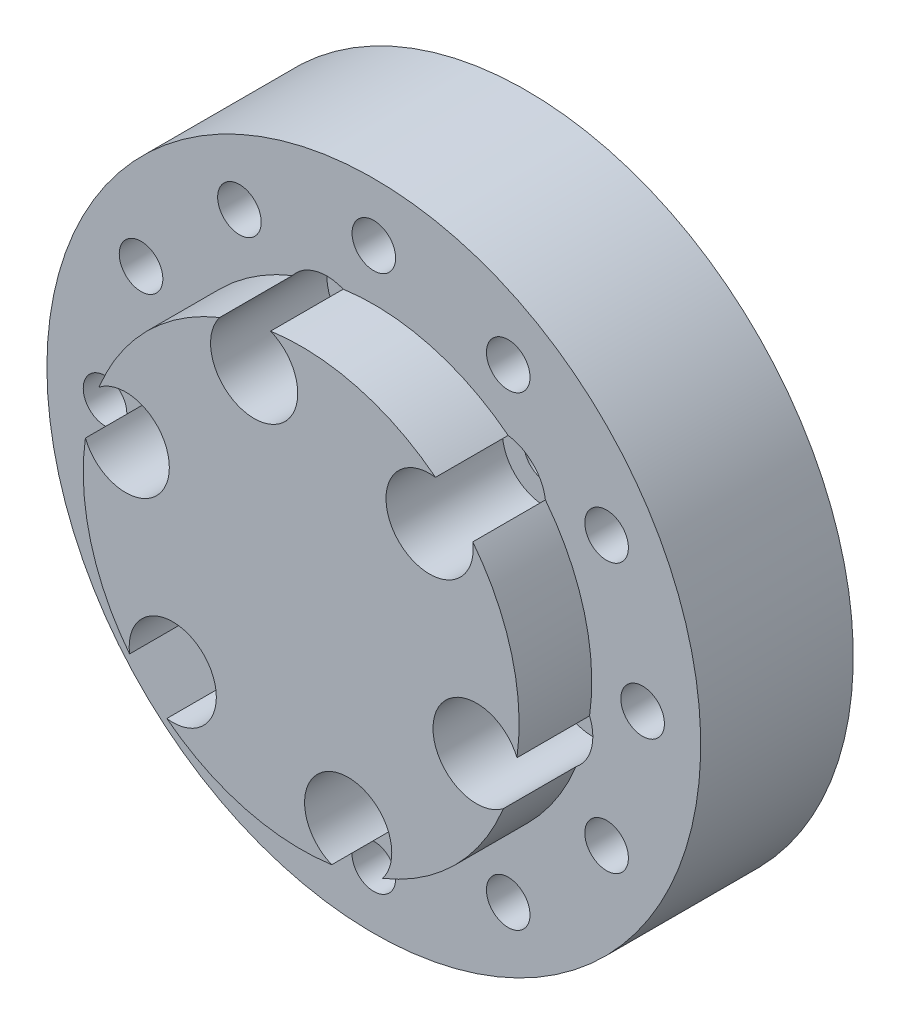
from build123d import *

# Parameters (mm, degrees)
SKETCH_1_R               = 22.5
EXTRUDE_1_DEPTH          = 10.5
SKETCH_2_R               = 15
EXTRUDE_2_DEPTH          = 5
SKETCH_3_R               = 1.5
CUT_EXTRUDE_1_DEPTH      = 5
SKETCH_5_R               = 1.5
CUT_EXTRUDE_2_DEPTH      = 34.507461856
CUT_EXTRUDE_6_DEPTH      = 3
PATTERN_CIRCULAR_1_COUNT = 12
SKETCH_6_R               = 1.5
CUT_EXTRUDE_3_DEPTH      = 36.394208566
SKETCH_7_R               = 3
CUT_EXTRUDE_4_DEPTH      = 8
PATTERN_CIRCULAR_2_COUNT = 6
SKETCH_8_R               = 2
CUT_EXTRUDE_5_DEPTH      = 4
PATTERN_CIRCULAR_3_COUNT = 6


with BuildPart() as part:
    # 草图1 → 凸台-拉伸1 (new body)
    with BuildSketch(Plane.XY):
        with Locations(Location((0, 0, 0), (0, 0, 180))):
            Circle(SKETCH_1_R)
    extrude(amount=EXTRUDE_1_DEPTH)

    # 草图2 → 凸台-拉伸2 (add)
    with BuildSketch(Plane.XY.offset(10.5)):
        Circle(SKETCH_2_R)
    extrude(amount=EXTRUDE_2_DEPTH)

    # 草图3 → 切除-拉伸1 (cut)
    with BuildSketch(Plane.XY.offset(10.5)):
        with Locations((0, 18.5)):
            Circle(SKETCH_3_R)
    cut_extrude_1 = extrude(amount=-CUT_EXTRUDE_1_DEPTH, mode=Mode.SUBTRACT)

    # 草图5 → 切除-拉伸2 (cut, through all)
    with BuildSketch(Plane.XY.offset(10.5)):
        with Locations((0, 18.5)):
            Circle(SKETCH_5_R)
    cut_extrude_2 = extrude(amount=-CUT_EXTRUDE_2_DEPTH, mode=Mode.SUBTRACT)

    # 草图9 → 切除-拉伸6 (cut)
    with BuildSketch(Plane(origin=(0, 0, 0), x_dir=(-1, 0, 0), z_dir=(0, 0, -1))):
        Polygon((1.313991975, 21.705218415), (-2.118804585, 21.240559639), (-3.43279656, 18.035341223), (-1.313991975, 15.294781585), (2.118804585, 15.759440361), (3.43279656, 18.964658777), align=None)
    cut_extrude_6 = extrude(amount=-CUT_EXTRUDE_6_DEPTH, mode=Mode.SUBTRACT)

    # 阵列(圆周)1: 切除-拉伸1, 切除-拉伸2, 切除-拉伸6 ×12 about axis
    pattern_circular_1_axis = Axis((0, 0, 0), (0, 0, 1))
    add([cut_extrude_1.rotate(pattern_circular_1_axis, i * 360 / PATTERN_CIRCULAR_1_COUNT) for i in range(1, PATTERN_CIRCULAR_1_COUNT)], mode=Mode.SUBTRACT)
    add([cut_extrude_2.rotate(pattern_circular_1_axis, i * 360 / PATTERN_CIRCULAR_1_COUNT) for i in range(1, PATTERN_CIRCULAR_1_COUNT)], mode=Mode.SUBTRACT)
    add([cut_extrude_6.rotate(pattern_circular_1_axis, i * 360 / PATTERN_CIRCULAR_1_COUNT) for i in range(1, PATTERN_CIRCULAR_1_COUNT)], mode=Mode.SUBTRACT)

    # 草图6 → 切除-拉伸3 (cut, through all)
    with BuildSketch(Plane(origin=(0, 0, 0), x_dir=(-1, 0, 0), z_dir=(0, 0, -1))):
        with Locations((3.235238064, 12.074072829)):
            Circle(SKETCH_6_R)
    cut_extrude_3 = extrude(amount=-CUT_EXTRUDE_3_DEPTH, mode=Mode.SUBTRACT)

    # 草图7 → 切除-拉伸4 (cut)
    with BuildSketch(Plane.XY.offset(15.5)):
        with Locations((-3.235238064, 12.074072829)):
            Circle(SKETCH_7_R)
    cut_extrude_4 = extrude(amount=-CUT_EXTRUDE_4_DEPTH, mode=Mode.SUBTRACT)

    # 阵列(圆周)2: 切除-拉伸3, 切除-拉伸4 ×6 about axis
    pattern_circular_2_axis = Axis((0, 0, 0), (0, 0, 1))
    add([cut_extrude_3.rotate(pattern_circular_2_axis, i * 360 / PATTERN_CIRCULAR_2_COUNT) for i in range(1, PATTERN_CIRCULAR_2_COUNT)], mode=Mode.SUBTRACT)
    add([cut_extrude_4.rotate(pattern_circular_2_axis, i * 360 / PATTERN_CIRCULAR_2_COUNT) for i in range(1, PATTERN_CIRCULAR_2_COUNT)], mode=Mode.SUBTRACT)

    # 草图8 → 切除-拉伸5 (cut)
    with BuildSketch(Plane(origin=(0, 0, 0), x_dir=(-1, 0, 0), z_dir=(0, 0, -1))):
        with Locations((-2.63995426, 9.852443428)):
            Circle(SKETCH_8_R)
    cut_extrude_5 = extrude(amount=-CUT_EXTRUDE_5_DEPTH, mode=Mode.SUBTRACT)

    # 阵列(圆周)3: 切除-拉伸5 ×6 about axis
    pattern_circular_3_axis = Axis((0, 0, 0), (0, 0, 1))
    for i in range(1, PATTERN_CIRCULAR_3_COUNT):
        add(cut_extrude_5.rotate(pattern_circular_3_axis, i * 360 / PATTERN_CIRCULAR_3_COUNT), mode=Mode.SUBTRACT)


solid = part.part
